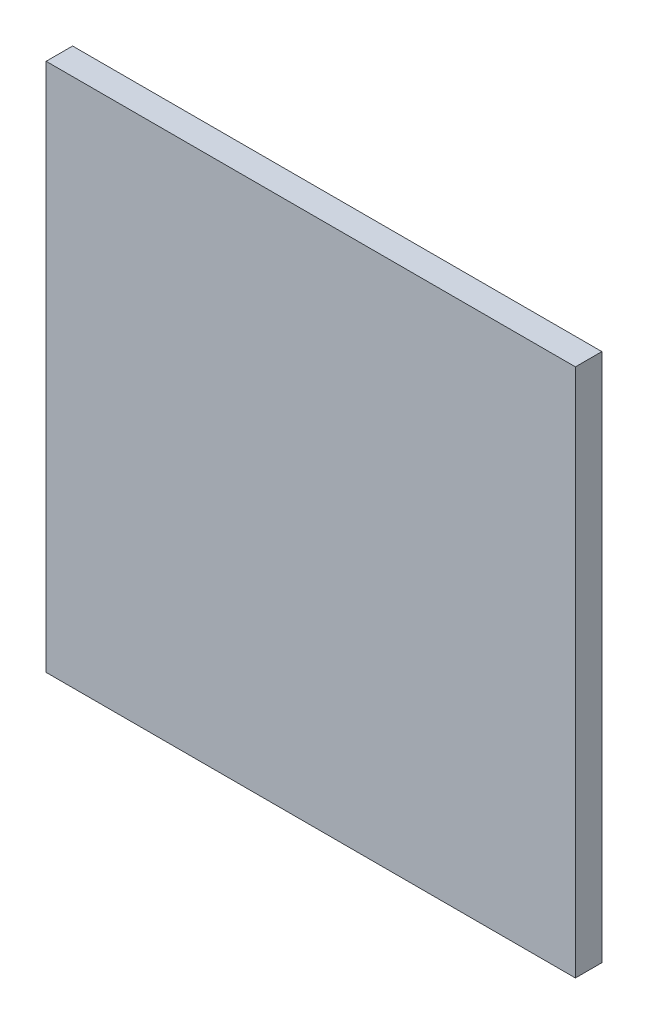
from build123d import *

# Parameters (mm, degrees)
SKETCH_1_W      = 20
SKETCH_1_H      = 20
EXTRUDE_1_DEPTH = 1


with BuildPart() as part:
    # Эскиз1 → Бобышка-Вытянуть1 (new body)
    with BuildSketch(Plane.XY):
        Rectangle(SKETCH_1_W, SKETCH_1_H)
    extrude(amount=EXTRUDE_1_DEPTH)


solid = part.part
